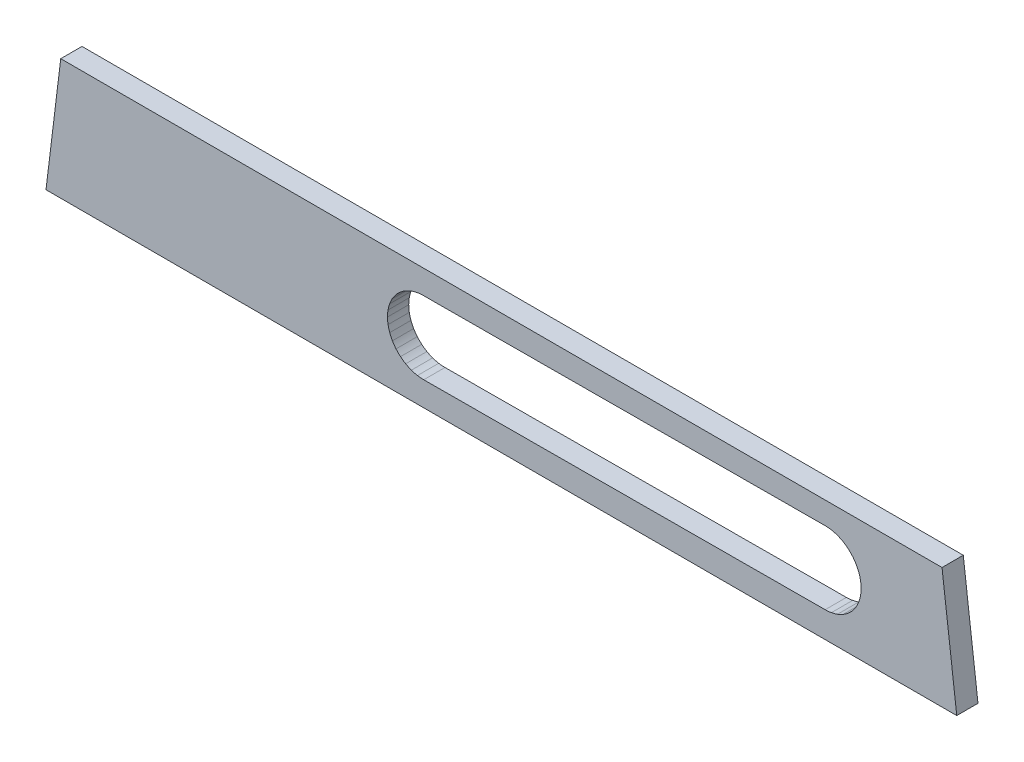
from build123d import *

# Parameters (mm, degrees)
BOSS_EXTRUDE1_DEPTH = 10


with BuildPart() as part:
    # Model → Boss-Extrude1 (new body)
    with BuildSketch(Plane.XY):
        Polygon((28.595430627, 208.079406788), (457.402364394, 208.079406788), (450.465147668, 265.002801404), (35.532647353, 265.002801404), align=None)
        with BuildLine():
            Line((395.310996933, 254.538077216), (206.313334547, 253.79734179))
            ThreePointArc((206.313334547, 253.79734179), (204.831877168, 253.726342411), (203.362371854, 253.525566384))
            ThreePointArc((203.362371854, 253.525566384), (201.915523421, 253.196404178), (200.503112299, 252.741637237))
            ThreePointArc((200.503112299, 252.741637237), (199.134879559, 252.164276657), (197.822433038, 251.469373641))
            ThreePointArc((197.822433038, 251.469373641), (196.574446388, 250.661348154), (195.401785154, 249.747432679))
            ThreePointArc((195.401785154, 249.747432679), (194.312018164, 248.73331433), (193.314718807, 247.628134658))
            ThreePointArc((193.314718807, 247.628134658), (192.416254629, 246.43882667), (191.624648452, 245.175873375))
            ThreePointArc((191.624648452, 245.175873375), (190.944865739, 243.847507192), (190.382926022, 242.465159548))
            ThreePointArc((190.382926022, 242.465159548), (189.942468925, 241.038153288), (189.627280625, 239.578356845))
            ThreePointArc((189.627280625, 239.578356845), (189.439494965, 238.096112854), (189.380672163, 236.603179306))
            ThreePointArc((189.380672163, 236.603179306), (189.451209877, 235.110754019), (189.65059371, 233.630026194))
            ThreePointArc((189.65059371, 233.630026194), (189.977255318, 232.172756129), (190.428843836, 230.749235263))
            ThreePointArc((190.428843836, 230.749235263), (191.001660076, 229.37136212), (191.691775805, 228.048337887))
            ThreePointArc((191.691775805, 228.048337887), (192.493322165, 226.791673876), (193.401016068, 225.609399465))
            ThreePointArc((193.401016068, 225.609399465), (194.406947639, 224.512071023), (195.504630226, 223.506525909))
            ThreePointArc((195.504630226, 223.506525909), (196.684373261, 222.601764862), (197.938701025, 221.803611967))
            ThreePointArc((197.938701025, 221.803611967), (199.256526594, 221.11895856), (200.629270456, 220.552399817))
            ThreePointArc((200.629270456, 220.552399817), (202.045191851, 220.108676612), (203.494586929, 219.790906907))
            ThreePointArc((203.494586929, 219.790906907), (204.965619617, 219.601640863), (206.447589253, 219.542270814))
            Line((206.447589253, 219.542270814), (395.445251639, 220.28300624))
            ThreePointArc((395.445251639, 220.28300624), (396.926709019, 220.354005619), (398.396214333, 220.554781645))
            ThreePointArc((398.396214333, 220.554781645), (399.843062766, 220.883943851), (401.255473887, 221.338710792))
            ThreePointArc((401.255473887, 221.338710792), (402.623706627, 221.916071373), (403.936153148, 222.610974389))
            ThreePointArc((403.936153148, 222.610974389), (405.184139798, 223.418999875), (406.356801033, 224.33291535))
            ThreePointArc((406.356801033, 224.33291535), (407.446568022, 225.347033699), (408.44386738, 226.452213372))
            ThreePointArc((408.44386738, 226.452213372), (409.342331557, 227.641521359), (410.133937735, 228.904474655))
            ThreePointArc((410.133937735, 228.904474655), (410.813720448, 230.232840838), (411.375660165, 231.615188482))
            ThreePointArc((411.375660165, 231.615188482), (411.816117262, 233.042194741), (412.131305562, 234.501991184))
            ThreePointArc((412.131305562, 234.501991184), (412.319091222, 235.984235175), (412.377914024, 237.477168724))
            ThreePointArc((412.377914024, 237.477168724), (412.30737631, 238.96959401), (412.107992477, 240.450321835))
            ThreePointArc((412.107992477, 240.450321835), (411.781330869, 241.9075919), (411.329742351, 243.331112767))
            ThreePointArc((411.329742351, 243.331112767), (410.756926111, 244.708985909), (410.066810382, 246.032010143))
            ThreePointArc((410.066810382, 246.032010143), (409.265264021, 247.288674153), (408.357570118, 248.470948564))
            ThreePointArc((408.357570118, 248.470948564), (407.351638547, 249.568277006), (406.253955961, 250.57382212))
            ThreePointArc((406.253955961, 250.57382212), (405.074212926, 251.478583167), (403.819885162, 252.276736063))
            ThreePointArc((403.819885162, 252.276736063), (402.502059592, 252.961389469), (401.129315731, 253.527948213))
            ThreePointArc((401.129315731, 253.527948213), (399.713394336, 253.971671417), (398.263999257, 254.289441123))
            ThreePointArc((398.263999257, 254.289441123), (396.792966569, 254.478707167), (395.310996933, 254.538077216))
        make_face(mode=Mode.SUBTRACT)
    extrude(amount=BOSS_EXTRUDE1_DEPTH)


solid = part.part
